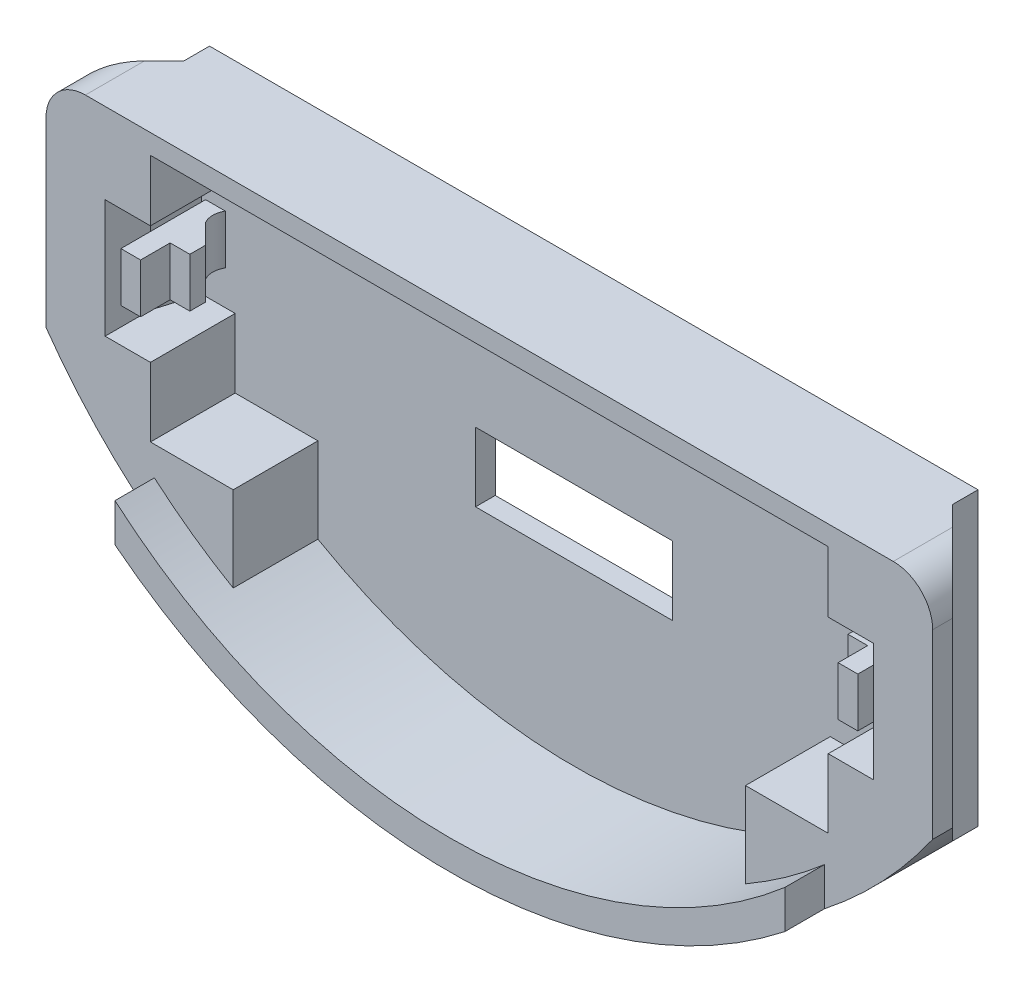
from build123d import *

# Parameters (mm, degrees)
SKETCH1_W           = 1
SKETCH1_H           = 2.5
SKETCH1_W_2         = 10
SKETCH1_H_2         = 3.5
BOSS_EXTRUDE1_DEPTH = 1
BOSS_EXTRUDE2_START = 4.3
SKETCH1_3_W         = 1
SKETCH1_3_H         = 2.5
BOSS_EXTRUDE2_DEPTH = 4.3
CUT_EXTRUDE1_REACH  = 29.14
CUT_EXTRUDE2_DEPTH  = 33.393667716
BOSS_EXTRUDE4_START = 2
BOSS_EXTRUDE4_DEPTH = 2
SKETCH3_5_W         = 1
SKETCH3_5_H         = 0.8
BOSS_EXTRUDE5_DEPTH = 2.5
BOSS_EXTRUDE6_REACH = 31.992


with BuildPart() as part:
    # Sketch1 → Boss-Extrude1 (new body)
    # profile 1 of 4: a face of its own
    with BuildSketch(Plane(origin=(0, 0, 0), x_dir=(-1, 0, 0), z_dir=(0, 0, 1))):
        with BuildLine():
            ThreePointArc((-20.5, -7.1), (-21.914213562, -6.514213562), (-22.5, -5.1))
            Line((-22.5, -5.1), (-22.5, 4.115748324))
            ThreePointArc((-22.5, 4.115748324), (0, 15.804360023), (22.5, 4.115748324))
            Line((22.5, 4.115748324), (22.5, -5.1))
            ThreePointArc((22.5, -5.1), (21.914213562, -6.514213562), (20.5, -7.1))
            Line((20.5, -7.1), (-20.5, -7.1))
        make_face()
        with BuildLine():
            Line((-13, 6.5), (-13, 10.821020521))
            ThreePointArc((-13, 10.821020521), (0, 14.304360023), (13, 10.821020521))
            Line((13, 10.821020521), (13, 6.5))
            Line((13, 6.5), (17.2, 6.5))
            Line((17.2, 6.5), (17.2, 3))
            Line((17.2, 3), (19.5, 3))
            Line((19.5, 3), (19.5, -3))
            Line((19.5, -3), (17.2, -3))
            Line((17.2, -3), (17.2, -6.1))
            Line((17.2, -6.1), (-17.2, -6.1))
            Line((-17.2, -6.1), (-17.2, -3))
            Line((-17.2, -3), (-19.5, -3))
            Line((-19.5, -3), (-19.5, 3))
            Line((-19.5, 3), (-17.2, 3))
            Line((-17.2, 3), (-17.2, 6.5))
            Line((-17.2, 6.5), (-13, 6.5))
        make_face(mode=Mode.SUBTRACT)
    # profile 2 of 4: a face of its own
    with BuildSketch(Plane(origin=(0, 0, 0), x_dir=(-1, 0, 0), z_dir=(0, 0, 1))):
        with BuildLine():
            ThreePointArc((-13, 10.821020521), (0, 14.304360023), (13, 10.821020521))
            Line((13, 10.821020521), (13, 6.5))
            Line((13, 6.5), (17.2, 6.5))
            Line((17.2, 6.5), (17.2, 3))
            Line((17.2, 3), (19.5, 3))
            Line((19.5, 3), (19.5, -3))
            Line((19.5, -3), (17.2, -3))
            Line((17.2, -3), (17.2, -6.1))
            Line((17.2, -6.1), (-17.2, -6.1))
            Line((-17.2, -6.1), (-17.2, -3))
            Line((-17.2, -3), (-19.5, -3))
            Line((-19.5, -3), (-19.5, 3))
            Line((-19.5, 3), (-17.2, 3))
            Line((-17.2, 3), (-17.2, 6.5))
            Line((-17.2, 6.5), (-13, 6.5))
            Line((-13, 6.5), (-13, 10.821020521))
        make_face()
        with Locations((-18.2, 0)):
            Rectangle(SKETCH1_W, SKETCH1_H, mode=Mode.SUBTRACT)
        with Locations((0, 3.65)):
            Rectangle(SKETCH1_W_2, SKETCH1_H_2, mode=Mode.SUBTRACT)
        with Locations((18.2, 0)):
            Rectangle(SKETCH1_W, SKETCH1_H, mode=Mode.SUBTRACT)
    # profile 3 of 4: a face of its own
    with BuildSketch(Plane(origin=(0, 0, 0), x_dir=(-1, 0, 0), z_dir=(0, 0, 1))):
        with Locations((18.2, 0)):
            Rectangle(SKETCH1_W, SKETCH1_H)
    # profile 4 of 4: a face of its own
    with BuildSketch(Plane(origin=(0, 0, 0), x_dir=(-1, 0, 0), z_dir=(0, 0, 1))):
        with Locations((-18.2, 0)):
            Rectangle(SKETCH1_W, SKETCH1_H)
    extrude(amount=-BOSS_EXTRUDE1_DEPTH)

    # Sketch1<3> → Boss-Extrude2 (add)
    # profile 1 of 3: a face of its own
    with BuildSketch(Plane(origin=(0, 0, 0), x_dir=(-1, 0, 0), z_dir=(0, 0, 1)).offset(BOSS_EXTRUDE2_START)):
        with BuildLine():
            ThreePointArc((-20.5, -7.1), (-21.914213562, -6.514213562), (-22.5, -5.1))
            Line((-22.5, -5.1), (-22.5, 4.115748324))
            ThreePointArc((-22.5, 4.115748324), (0, 15.804360023), (22.5, 4.115748324))
            Line((22.5, 4.115748324), (22.5, -5.1))
            ThreePointArc((22.5, -5.1), (21.914213562, -6.514213562), (20.5, -7.1))
            Line((20.5, -7.1), (-20.5, -7.1))
        make_face()
        with BuildLine():
            Line((-13, 6.5), (-13, 10.821020521))
            ThreePointArc((-13, 10.821020521), (0, 14.304360023), (13, 10.821020521))
            Line((13, 10.821020521), (13, 6.5))
            Line((13, 6.5), (17.2, 6.5))
            Line((17.2, 6.5), (17.2, 3))
            Line((17.2, 3), (19.5, 3))
            Line((19.5, 3), (19.5, -3))
            Line((19.5, -3), (17.2, -3))
            Line((17.2, -3), (17.2, -6.1))
            Line((17.2, -6.1), (-17.2, -6.1))
            Line((-17.2, -6.1), (-17.2, -3))
            Line((-17.2, -3), (-19.5, -3))
            Line((-19.5, -3), (-19.5, 3))
            Line((-19.5, 3), (-17.2, 3))
            Line((-17.2, 3), (-17.2, 6.5))
            Line((-17.2, 6.5), (-13, 6.5))
        make_face(mode=Mode.SUBTRACT)
    # profile 2 of 3: a face of its own
    with BuildSketch(Plane(origin=(0, 0, 0), x_dir=(-1, 0, 0), z_dir=(0, 0, 1)).offset(BOSS_EXTRUDE2_START)):
        with Locations((18.2, 0)):
            Rectangle(SKETCH1_3_W, SKETCH1_3_H)
    # profile 3 of 3: a face of its own
    with BuildSketch(Plane(origin=(0, 0, 0), x_dir=(-1, 0, 0), z_dir=(0, 0, 1)).offset(BOSS_EXTRUDE2_START)):
        with Locations((-18.2, 0)):
            Rectangle(SKETCH1_3_W, SKETCH1_3_H)
    extrude(amount=-BOSS_EXTRUDE2_DEPTH)

    # Sketch3 → Cut-Extrude1 (cut, up to next)
    with BuildSketch(Plane.XZ.offset(1.25), mode=Mode.PRIVATE) as cut_extrude1_sk1:
        with BuildLine():
            Line((-17.7, 0), (-17.7, 1))
            ThreePointArc((-17.7, 1), (-17.833974596, 0.5), (-17.7, 0))
        make_face()
    cut_extrude1_tool1 = extrude(cut_extrude1_sk1.sketch, amount=-CUT_EXTRUDE1_REACH, mode=Mode.PRIVATE) & part.part
    # Sketch3 → Cut-Extrude1 (cut, up to next)
    with BuildSketch(Plane.XZ.offset(1.25), mode=Mode.PRIVATE) as cut_extrude1_sk2:
        with BuildLine():
            ThreePointArc((17.7, 0), (17.833974596, 0.5), (17.7, 1))
            Line((17.7, 1), (17.7, 0))
        make_face()
    cut_extrude1_tool2 = extrude(cut_extrude1_sk2.sketch, amount=-CUT_EXTRUDE1_REACH, mode=Mode.PRIVATE) & part.part
    add(cut_extrude1_tool1.solids().sort_by_distance((-17.75391, -1.25, 0.5))[0], mode=Mode.SUBTRACT)
    add(cut_extrude1_tool2.solids().sort_by_distance((17.75391, -1.25, 0.5))[0], mode=Mode.SUBTRACT)

    # Sketch4 → Cut-Extrude2 (cut, through all)
    with BuildSketch(Plane(origin=(0, 7.1, 0), x_dir=(1, 0, 0), z_dir=(0, 1, 0))):
        Polygon((19.5, 1), (19.5, -0.3), (22.5, -3.3), (22.5, 1), align=None)
        Polygon((-19.5, -0.3), (-22.5, -3.3), (-22.5, 1), (-19.5, 1), align=None)
    extrude(amount=-CUT_EXTRUDE2_DEPTH, mode=Mode.SUBTRACT)

    # Sketch5 → Boss-Extrude4 (add)
    with BuildSketch(Plane.XY.offset(4.3).offset(BOSS_EXTRUDE4_START)):
        with BuildLine():
            Line((17, -7.976675596), (17, -9.920326344))
            ThreePointArc((17, -9.920326344), (0, -15.804360023), (-17, -9.920326344))
            Line((-17, -9.920326344), (-17, -7.976675596))
            ThreePointArc((-17, -7.976675596), (0, -14.304360023), (17, -7.976675596))
        make_face()
    extrude(amount=-BOSS_EXTRUDE4_DEPTH)

    # Sketch3<5> → Boss-Extrude5 (add)
    with BuildSketch(Plane.XZ.offset(1.25)):
        with Locations((17.2, 2.4)):
            Rectangle(SKETCH3_5_W, SKETCH3_5_H)
        Polygon((16.7, 2), (17.7, 2), (17.7, 1), align=None)
        with Locations((-17.2, 2.4)):
            Rectangle(SKETCH3_5_W, SKETCH3_5_H)
        Polygon((-16.7, 2), (-17.7, 2), (-17.7, 1), align=None)
    extrude(amount=-BOSS_EXTRUDE5_DEPTH)

    # Sketch6 → Boss-Extrude6 (add, up to next)
    with BuildSketch(Plane.XZ.offset(-3), mode=Mode.PRIVATE) as boss_extrude6_sk1:
        Polygon((19.5, 2), (19.5, 0), (18.9, 0), align=None)
    boss_extrude6_tool1 = extrude(boss_extrude6_sk1.sketch, amount=BOSS_EXTRUDE6_REACH, mode=Mode.PRIVATE) - part.part
    # Sketch6 → Boss-Extrude6 (add, up to next)
    with BuildSketch(Plane.XZ.offset(-3), mode=Mode.PRIVATE) as boss_extrude6_sk2:
        Polygon((-18.9, 0), (-19.5, 2), (-19.5, 0), align=None)
    boss_extrude6_tool2 = extrude(boss_extrude6_sk2.sketch, amount=BOSS_EXTRUDE6_REACH, mode=Mode.PRIVATE) - part.part
    add(boss_extrude6_tool1.solids().sort_by_distance((19.3, 3, 0.666667))[0])
    add(boss_extrude6_tool2.solids().sort_by_distance((-19.3, 3, 0.666667))[0])


solid = part.part
